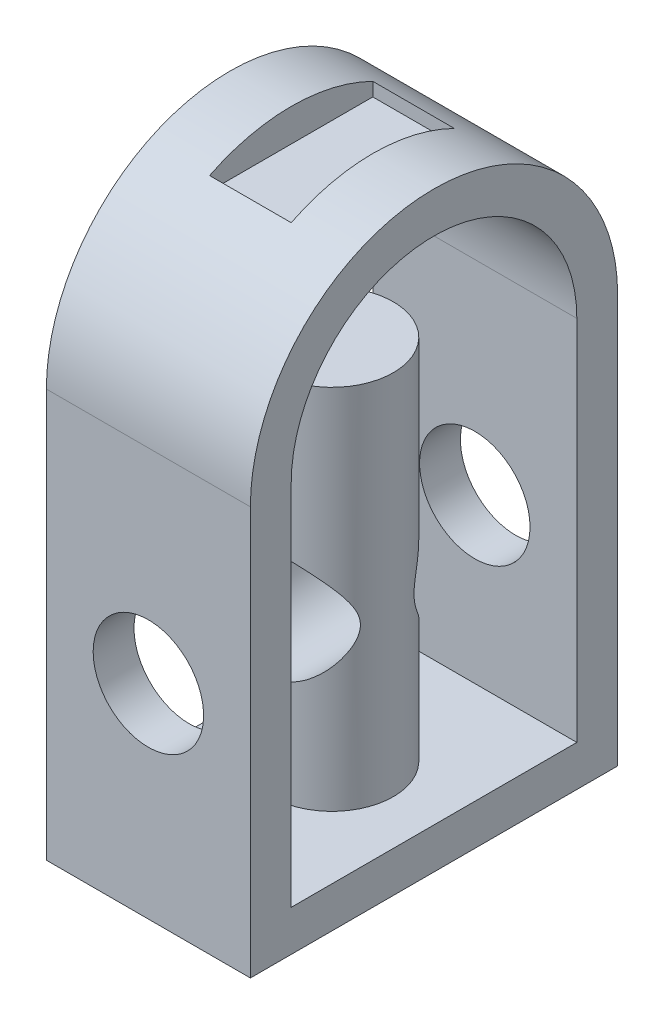
from build123d import *

# Parameters (mm, degrees)
BOSS_EXTRUDE2_DEPTH = 127
SKETCH2_W           = 50.8
SKETCH2_H           = 101.6
CUT_EXTRUDE1_DEPTH  = 20.32
SKETCH4_R           = 38.212912671
BOSS_EXTRUDE3_DEPTH = 228.6
SKETCH5_R           = 34.379676842
CUT_EXTRUDE2_DEPTH  = 433.591157561


with BuildPart() as part:
    # Sketch1 → Boss-Extrude2 (new body)
    with BuildSketch(Plane(origin=(0, 0, 0), x_dir=(0, 0, -1), z_dir=(1, 0, 0))):
        with BuildLine():
            Line((-25.4, -25.4), (-25.4, 228.6))
            ThreePointArc((-25.4, 228.6), (88.9, 342.9), (203.2, 228.6))
            Line((203.2, 228.6), (203.2, -25.4))
            Line((203.2, -25.4), (-25.4, -25.4))
        make_face()
        with BuildLine():
            Line((0, 0), (177.8, 0))
            Line((177.8, 0), (177.8, 228.6))
            ThreePointArc((177.8, 228.6), (88.9, 317.5), (0, 228.6))
            Line((0, 228.6), (0, 0))
        make_face(mode=Mode.SUBTRACT)
    extrude(amount=BOSS_EXTRUDE2_DEPTH)

    # Sketch2 → Cut-Extrude1 (cut)
    with BuildSketch(Plane(origin=(0, 342.9, 0), x_dir=(1, 0, 0), z_dir=(0, 1, 0))):
        with Locations((63.5, 88.9)):
            Rectangle(SKETCH2_W, SKETCH2_H)
    extrude(amount=-CUT_EXTRUDE1_DEPTH, mode=Mode.SUBTRACT)


with BuildPart() as body_2:
    # Sketch4 → Boss-Extrude3 (new body)
    with BuildSketch(Plane(origin=(0, 2.54, 0), x_dir=(1, 0, 0), z_dir=(0, 1, 0))):
        with Locations(Location((63.5, 88.9, 0), (0, 0, 270))):
            Circle(SKETCH4_R)
    extrude(amount=BOSS_EXTRUDE3_DEPTH)


with BuildPart() as cut_extrude2_tool:
    # Sketch5 → Cut-Extrude2 (new, through all)
    with BuildSketch(Plane(origin=(0, 0, -205.74), x_dir=(-1, 0, 0), z_dir=(0, 0, -1))):
        with Locations(Location((-63.5, 101.6, 0), (0, 0, 90.000000002))):
            Circle(SKETCH5_R)
    extrude(amount=-CUT_EXTRUDE2_DEPTH)


with BuildPart() as part_1:
    add(part.part)

    # Cut-Extrude2: cut by cut_extrude2_tool
    add(cut_extrude2_tool.part, mode=Mode.SUBTRACT)


with BuildPart() as body_2_1:
    add(body_2.part)

    # Cut-Extrude2: cut by cut_extrude2_tool
    add(cut_extrude2_tool.part, mode=Mode.SUBTRACT)


solid = Compound([part_1.part, body_2_1.part])
